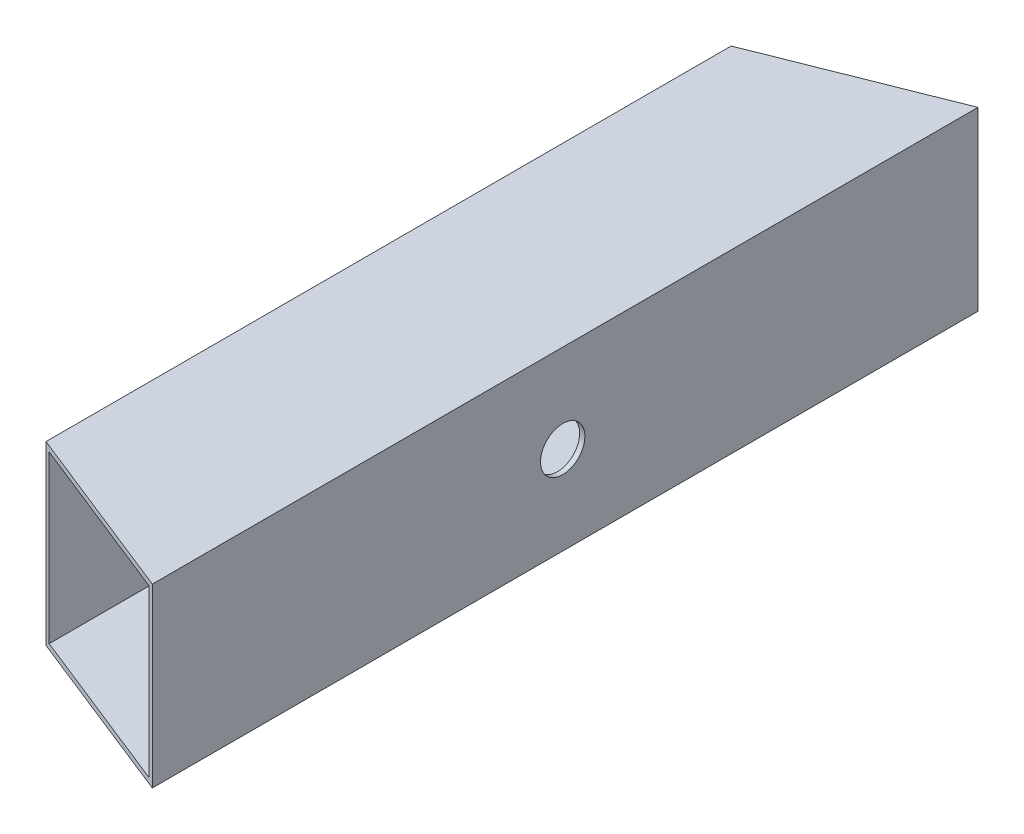
from build123d import *

# Parameters (mm, degrees)
ESBO_O1_W                = 31.890446896
ESBO_O1_H                = 31.890446896
ESBO_O1_W_2              = 30
ESBO_O1_H_2              = 30
RESSALTO_EXTRUS_O1_DEPTH = 149.11688245
CORTE_EXTRUS_O1_DEPTH    = 154.320238017
ESBO_O4_R                = 4
CORTE_EXTRUS_O2_DEPTH    = 32


with BuildPart() as part:
    # Esboço1 → Ressalto-extrusão1 (new body)
    with BuildSketch(Plane.XY):
        Rectangle(ESBO_O1_W, ESBO_O1_H)
        Rectangle(ESBO_O1_W_2, ESBO_O1_H_2, mode=Mode.SUBTRACT)
    extrude(amount=RESSALTO_EXTRUS_O1_DEPTH)

    # Esboço3 → Corte-extrusão1 (cut, symmetric)
    with BuildSketch(Plane(origin=(0, 15.945223448, 0), x_dir=(1, 0, 0), z_dir=(0, 1, 0))):
        Polygon((-15.945223448, -12.692594834), (15.945223448, 0), (-15.945223448, 0), align=None)
    corte_extrus_o1 = extrude(amount=CORTE_EXTRUS_O1_DEPTH, both=True, mode=Mode.SUBTRACT)

    # Espelhar5: Corte-extrusão1 across plane
    add(corte_extrus_o1.mirror(Plane(origin=(0, 0, 74.558441225), x_dir=(1, 0, 0), z_dir=(0, 0, -1))), mode=Mode.SUBTRACT)

    # Esboço4 → Corte-extrusão2 (cut)
    with BuildSketch(Plane.ZY.offset(15.945223448)):
        with Locations((75, 0)):
            Circle(ESBO_O4_R)
    extrude(amount=-CORTE_EXTRUS_O2_DEPTH, mode=Mode.SUBTRACT)


solid = part.part
